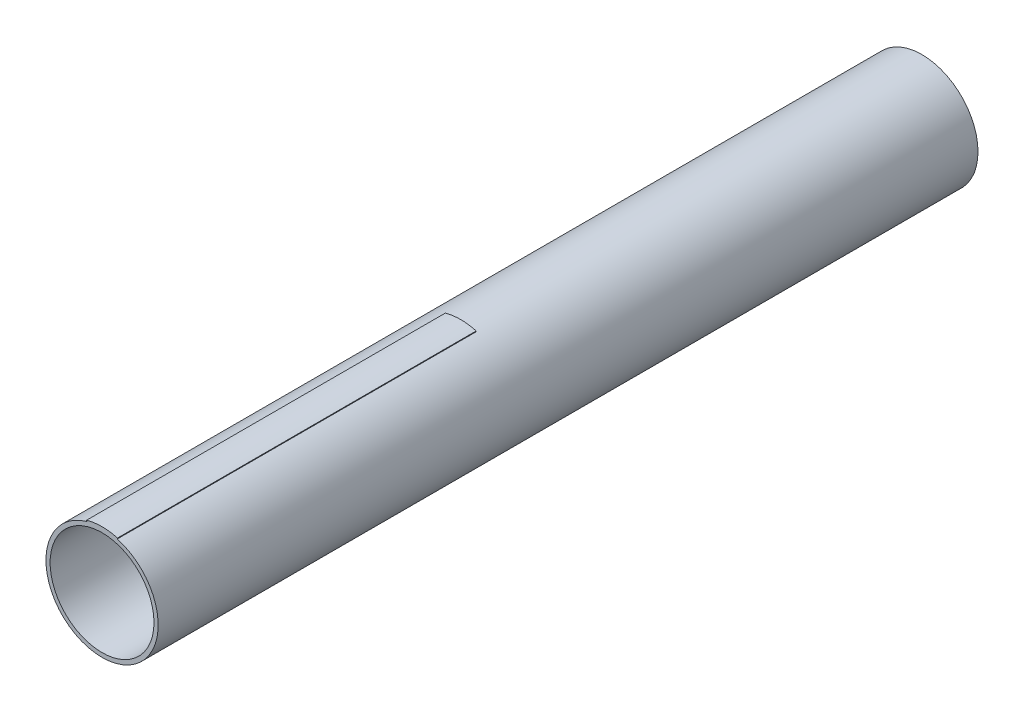
from build123d import *

# Parameters (mm, degrees)
BOSS_EXTRUDE1_DEPTH      = 800
BOSS_EXTRUDE1_DEPTH_BACK = 800
SKETCH3_R                = 109.5375
SKETCH3_R_2              = 101.3587
WRAP2_SECTION_W          = 2
WRAP2_SECTION_H          = 700
WRAP2_ANGLE              = 31.384199665


with BuildPart() as part:
    # Sketch3 → Boss-Extrude1 (new, two sides: drawn at the far end of the back side and taken through both)
    with BuildSketch(Plane.XY.offset(-BOSS_EXTRUDE1_DEPTH_BACK)):
        Circle(SKETCH3_R)
        Circle(SKETCH3_R_2, mode=Mode.SUBTRACT)
    extrude(amount=BOSS_EXTRUDE1_DEPTH + BOSS_EXTRUDE1_DEPTH_BACK)

    # Wrap2 section (on wrap section) → Wrap2 (revolve)
    with BuildSketch(Plane(origin=(0, 0, 0), x_dir=(-0.27046770367687717, 0.9627290487295773, 0), z_dir=(-0.9627290487295773, -0.27046770367687717, 0))):
        with Locations((110.5375, -450)):
            Rectangle(WRAP2_SECTION_W, WRAP2_SECTION_H)
    revolve(axis=Axis((0, 0, 0), (0, 0, -1)), revolution_arc=WRAP2_ANGLE)


solid = part.part
